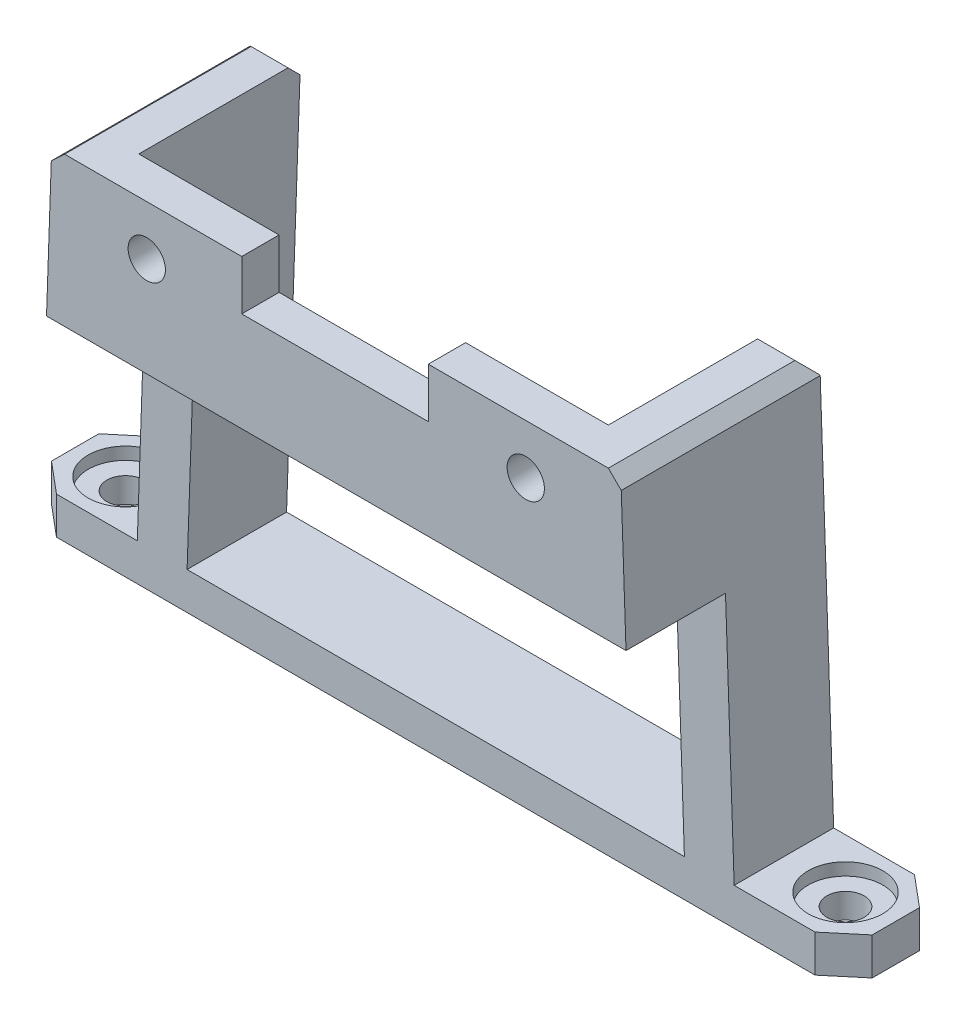
from build123d import *
from OCP.BRepFilletAPI import BRepFilletAPI_MakeChamfer

# Parameters (mm, degrees)
SKETCH1_W           = 66
SKETCH1_H           = 8
SKETCH1_R           = 1.5
BOSS_EXTRUDE1_DEPTH = 3
BOSS_EXTRUDE4_DEPTH = 8
BOSS_EXTRUDE6_DEPTH = 8
SKETCH7_R           = 3
CUT_EXTRUDE1_DEPTH  = 1
SKETCH8_W           = 15
SKETCH8_H           = 4
CUT_EXTRUDE2_DEPTH  = 8
CUT_EXTRUDE3_DEPTH  = 5
CHAMFER2_SIZE       = 1
CHAMFER2_SIZE2      = 1.036815955
SKETCH10_R          = 1.5
CUT_EXTRUDE4_DEPTH  = 3
CUT_EXTRUDE5_DEPTH  = 3


with BuildPart() as part:
    # Sketch1 → Boss-Extrude1 (new body)
    with BuildSketch(Plane(origin=(0, 0, 0), x_dir=(1, 0, 0), z_dir=(0, 1, 0))):
        Rectangle(SKETCH1_W, SKETCH1_H)
        with Locations(Location((-28.953010595, 0, 0), (0, 0, 270))):
            Circle(SKETCH1_R, mode=Mode.SUBTRACT)
        with Locations(Location((28.953010595, 0, 0), (0, 0, 270))):
            Circle(SKETCH1_R, mode=Mode.SUBTRACT)
    extrude(amount=BOSS_EXTRUDE1_DEPTH)

    # Sketch4 → Boss-Extrude4 (add)
    with BuildSketch(Plane.XY.offset(4)):
        Polygon((-24, 3), (-22.882535376, 35), (-18.880097199, 35), (-19.997561823, 3), align=None)
    boss_extrude4 = extrude(amount=-BOSS_EXTRUDE4_DEPTH)

    # Mirror1: Boss-Extrude4 across plane
    add(boss_extrude4.mirror(Plane(origin=(0, 0, 0), x_dir=(0, 0, 1), z_dir=(1, 0, 0))))

    # Sketch6 → Boss-Extrude6 (add)
    with BuildSketch(Plane.XY.offset(4)):
        Polygon((-22.882535376, 35), (22.882535376, 35), (23.30158461, 23), (-23.30158461, 23), align=None)
    extrude(amount=BOSS_EXTRUDE6_DEPTH)

    # Sketch7 → Cut-Extrude1 (cut)
    with BuildSketch(Plane(origin=(0, 3, 0), x_dir=(1, 0, 0), z_dir=(0, 1, 0))):
        with Locations(Location((-28.953010595, 0, 0), (0, 0, 270))):
            Circle(SKETCH7_R)
        with Locations(Location((28.953010595, 0, 0), (0, 0, 270))):
            Circle(SKETCH7_R)
    extrude(amount=-CUT_EXTRUDE1_DEPTH, mode=Mode.SUBTRACT)

    # Sketch8 → Cut-Extrude2 (cut)
    with BuildSketch(Plane.XY.offset(12)):
        with Locations((-0.1, 33)):
            Rectangle(SKETCH8_W, SKETCH8_H)
    extrude(amount=-CUT_EXTRUDE2_DEPTH, mode=Mode.SUBTRACT)

    # Sketch9 → Cut-Extrude3 (cut)
    with BuildSketch(Plane(origin=(0, 0, 4), x_dir=(-1, 0, 0), z_dir=(0, 0, -1))):
        Polygon((-19.299146433, 23), (19.299146433, 23), (18.880097199, 35), (-18.880097199, 35), align=None)
    extrude(amount=-CUT_EXTRUDE3_DEPTH, mode=Mode.SUBTRACT)

    # Chamfer2: one chamfer whose edges measure the first distance from different faces: ONE call of the kernel's chamfer builder (chamfer() names one face for all edges)
    chamfer2_edges_1 = [part.edges().sort_by_distance(p)[0] for p in [
        (-22.882535376, 35, 4),
    ]]
    chamfer2_side_1 = [part.faces().sort_by_distance(p)[0] for p in [
        (-23.346029226, 21.727272727, 2.181818182),
    ]]
    chamfer2_edges_2 = [part.edges().sort_by_distance(p)[0] for p in [
        (-20.881316288, 35, -4),
        (20.881316288, 35, -4),
    ]]
    chamfer2_edges_3 = [part.edges().sort_by_distance(p)[0] for p in [
        (22.882535376, 35, 4),
    ]]
    chamfer2_side_3 = [part.faces().sort_by_distance(p)[0] for p in [
        (22.659890165, 35, 4),
    ]]
    chamfer2 = BRepFilletAPI_MakeChamfer(part.part.solid().wrapped)
    for e in chamfer2_edges_1:
        chamfer2.Add(CHAMFER2_SIZE, CHAMFER2_SIZE2, e.wrapped, chamfer2_side_1[0].wrapped)  # the first distance lies on this face
    for e in chamfer2_edges_2:
        chamfer2.Add(CHAMFER2_SIZE, e.wrapped)
    for e in chamfer2_edges_3:
        chamfer2.Add(CHAMFER2_SIZE, CHAMFER2_SIZE2, e.wrapped, chamfer2_side_3[0].wrapped)  # the first distance lies on this face
    add(Compound.cast(chamfer2.Shape()), mode=Mode.REPLACE)

    # Sketch10 → Cut-Extrude4 (cut)
    with BuildSketch(Plane(origin=(0, 0, 9), x_dir=(-1, 0, 0), z_dir=(0, 0, -1))):
        with Locations((-15.24, 31)):
            Circle(SKETCH10_R)
        with Locations((15.24, 31)):
            Circle(SKETCH10_R)
    extrude(amount=-CUT_EXTRUDE4_DEPTH, mode=Mode.SUBTRACT)

    # Sketch13 → Cut-Extrude5 (cut)
    with BuildSketch(Plane(origin=(0, 3, 0), x_dir=(1, 0, 0), z_dir=(0, 1, 0))):
        Polygon((-30.5, 4), (-33, 1.902250922), (-33, 4), align=None)
        Polygon((-30.5, -4), (-33, -1.902250922), (-33, -4), align=None)
        Polygon((30.5, -4), (33, -1.902250922), (33, -4), align=None)
        Polygon((30.5, 4), (33, 1.902250922), (33, 4), align=None)
    extrude(amount=-CUT_EXTRUDE5_DEPTH, mode=Mode.SUBTRACT)


solid = part.part
